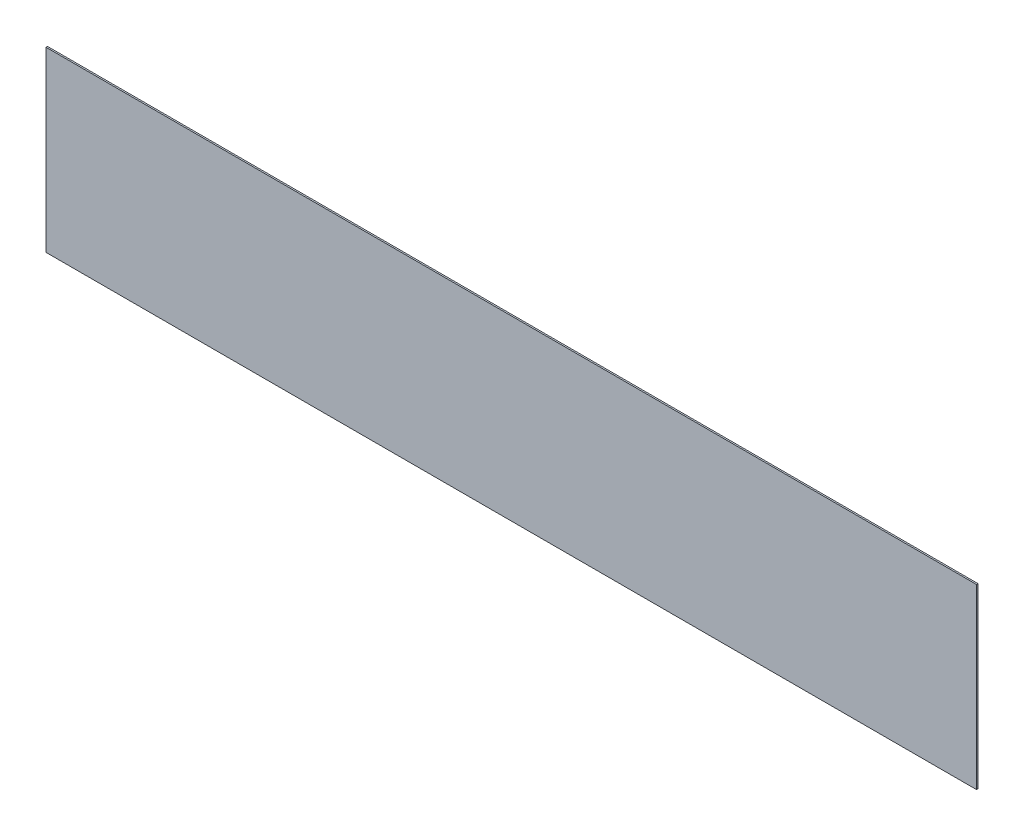
from build123d import *

# Parameters (mm, degrees)
SKETCH1_W                        = 618
SKETCH1_H                        = 118
CEK_ICECEK_ON_IC_SAC_1_0_1_DEPTH = 1


with BuildPart() as part:
    # Sketch1 → CEK_icecek_on_ic_sac_1.0_1 (new body)
    with BuildSketch(Plane.XY):
        with Locations((309, 59)):
            Rectangle(SKETCH1_W, SKETCH1_H)
    extrude(amount=CEK_ICECEK_ON_IC_SAC_1_0_1_DEPTH)


solid = part.part
